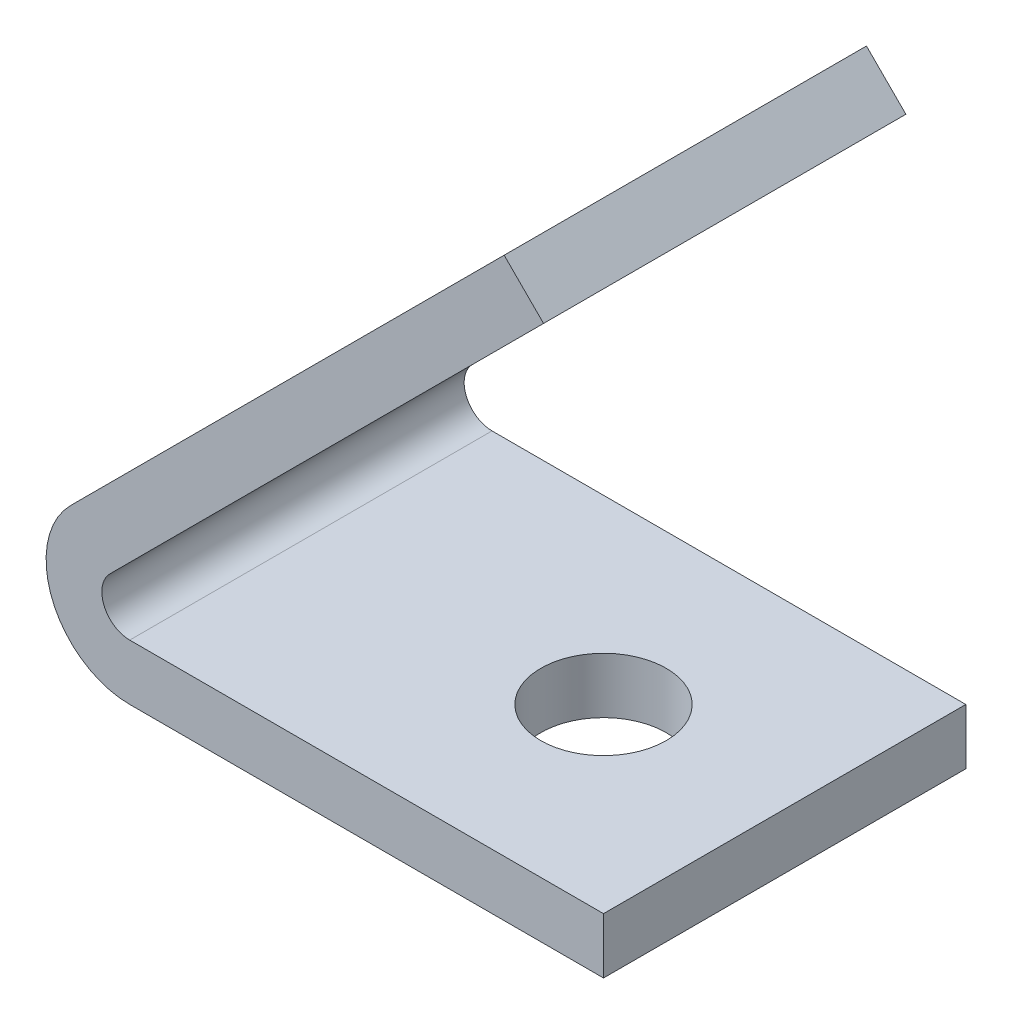
from build123d import *

# Parameters (mm, degrees)
EXTRUDE_THIN1_DEPTH = 20.6375
SKETCH2_R           = 7.14375
CUT_EXTRUDE1_DEPTH  = 6.35
SKETCH3_R           = 7.14375
CUT_EXTRUDE2_DEPTH  = 6.35


with BuildPart() as part:
    # Sketch1 → Extrude-Thin1 (new, symmetric)
    with BuildSketch(Plane.XY):
        with BuildLine():
            Line((63.5, 0), (9.525, 0))
            ThreePointArc((9.525, 0), (0.725047453, 5.879940307), (2.789807909, 16.260192091))
            Line((2.789807909, 16.260192091), (52.181216575, 65.651600757))
            Line((52.181216575, 65.651600757), (56.671344636, 61.161472696))
            Line((56.671344636, 61.161472696), (7.27993597, 11.77006403))
            ThreePointArc((7.27993597, 11.77006403), (6.591682484, 8.309980102), (9.525, 6.35))
            Line((9.525, 6.35), (63.5, 6.35))
            Line((63.5, 6.35), (63.5, 0))
        make_face()
    extrude(amount=EXTRUDE_THIN1_DEPTH, both=True)

    # Sketch2 → Cut-Extrude1 (cut)
    with BuildSketch(Plane.XZ):
        with Locations((42.8625, 0)):
            Circle(SKETCH2_R)
    extrude(amount=-CUT_EXTRUDE1_DEPTH, mode=Mode.SUBTRACT)

    # Sketch3 → Cut-Extrude2 (cut)
    with BuildSketch(Plane(origin=(-6.735192091, 6.735192091, 0), x_dir=(0, 0, 1), z_dir=(-0.7071067811865439, 0.7071067811865511, 0))):
        with Locations(Location((0, 62.682884182, 0), (0, 0, 270))):
            Circle(SKETCH3_R)
    extrude(amount=-CUT_EXTRUDE2_DEPTH, mode=Mode.SUBTRACT)


solid = part.part
